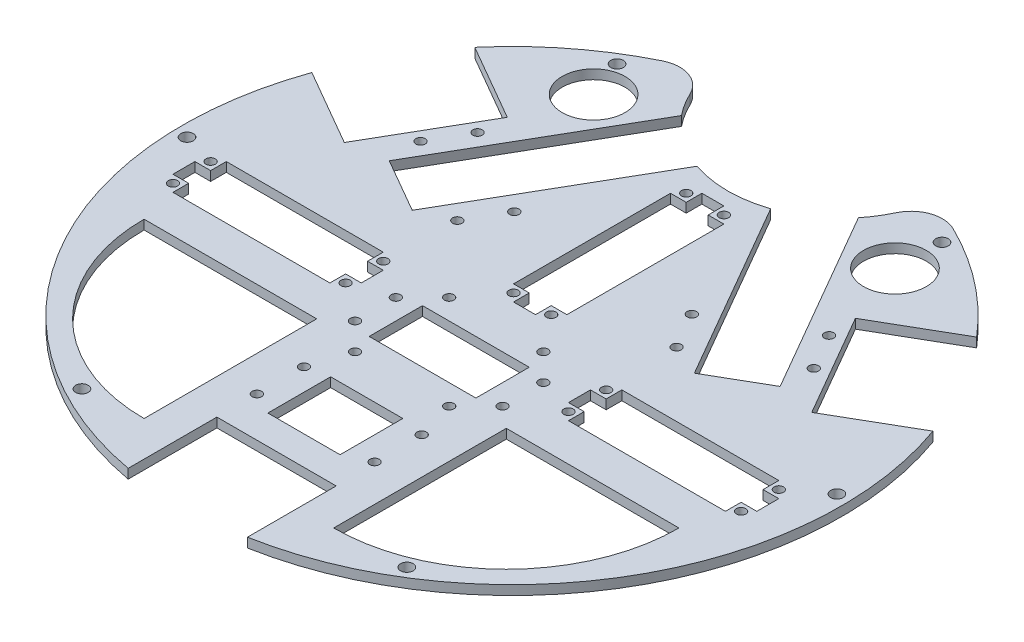
from build123d import *

# Parameters (mm, degrees)
CROQUIS1_R              = 105
SALIENTE_EXTRUIR1_DEPTH = 3
CORTAR_EXTRUIR1_START   = -3
CORTAR_EXTRUIR1_DEPTH   = 3
REDONDEO1_R             = 10
CROQUIS3_W              = 38
CROQUIS3_H              = 30
CORTAR_EXTRUIR2_DEPTH   = 149.522725677
MATRIZC2_COUNT          = 3
CORTAR_EXTRUIR3_DEPTH   = 148.302410171
CROQUIS5_R              = 1.5
CORTAR_EXTRUIR4_DEPTH   = 148.302410171
CROQUIS6_R              = 1.5
CORTAR_EXTRUIR5_DEPTH   = 148.302410171
CROQUIS7_R              = 1.5
CORTAR_EXTRUIR6_DEPTH   = 148.302410171
CROQUIS8_R              = 1.5
CORTAR_EXTRUIR8_DEPTH   = 10
CORTAR_EXTRUIR9_DEPTH   = 148.302410171
CROQUIS11_R             = 1.5
CORTAR_EXTRUIR10_DEPTH  = 148.302410171
CROQUIS12_R             = 1.5
CORTAR_EXTRUIR11_DEPTH  = 148.302410171
CROQUIS14_R             = 1.5
CORTAR_EXTRUIR15_DEPTH  = 148.302410171
CORTAR_EXTRUIR18_DEPTH  = 148.302410171
CROQUIS17_R             = 10
CORTAR_EXTRUIR19_DEPTH  = 148.302410171
CROQUIS19_R             = 1.5
CORTAR_EXTRUIR20_DEPTH  = 148.302410171
CROQUIS20_W             = 23
CROQUIS20_H             = 20
CORTAR_EXTRUIR21_DEPTH  = 148.302410171
CROQUIS21_R             = 1.5
CORTAR_EXTRUIR23_DEPTH  = 10
CROQUIS22_R             = 2
CORTAR_EXTRUIR24_DEPTH  = 148.302410171
CORTAR_EXTRUIR25_DEPTH  = 148.302410171
CROQUIS24_W             = 34
CROQUIS24_H             = 17
CORTAR_EXTRUIR26_DEPTH  = 148.302410171


with BuildPart() as part:
    # Croquis1 → Saliente-Extruir1 (new body)
    with BuildSketch(Plane(origin=(0, 0, 0), x_dir=(1, 0, 0), z_dir=(0, 1, 0))):
        with Locations(Location((0, 0, 0), (0, 0, 270))):
            Circle(CROQUIS1_R)
    extrude(amount=SALIENTE_EXTRUIR1_DEPTH)

    # Croquis2 → Cortar-Extruir1 (cut)
    with BuildSketch(Plane(origin=(0, 3, 0), x_dir=(1, 0, 0), z_dir=(0, 1, 0)).offset(CORTAR_EXTRUIR1_START)):
        with BuildLine():
            ThreePointArc((35.71668902, 98.738635424), (0, 68.738635424), (-35.71668902, 98.738635424))
            ThreePointArc((-35.71668902, 98.738635424), (0, 105), (35.71668902, 98.738635424))
        make_face()
    extrude(amount=CORTAR_EXTRUIR1_DEPTH, mode=Mode.SUBTRACT)

    # Redondeo1
    redondeo1_edges = [part.edges().sort_by_distance(p)[0] for p in [
        (-35.71668902, 1.5, -98.738635424),
        (35.71668902, 1.5, -98.738635424),
    ]]
    fillet(redondeo1_edges, radius=REDONDEO1_R)

    # Croquis3 → Cortar-Extruir2 (cut, through all)
    with BuildSketch(Plane(origin=(0, 3, 0), x_dir=(1, 0, 0), z_dir=(0, 1, 0))):
        with Locations((0, -90)):
            Rectangle(CROQUIS3_W, CROQUIS3_H)
    cortar_extruir2 = extrude(amount=-CORTAR_EXTRUIR2_DEPTH, mode=Mode.SUBTRACT)

    # MatrizC2: Cortar-Extruir2 ×3 about axis
    matrizc2_axis = Axis((0, 0, 0), (0, 1, 0))
    for i in range(1, MATRIZC2_COUNT):
        add(cortar_extruir2.rotate(matrizc2_axis, i * 360 / MATRIZC2_COUNT), mode=Mode.SUBTRACT)

    # Croquis4 → Cortar-Extruir3 (cut, through all)
    with BuildSketch(Plane(origin=(0, 3, 0), x_dir=(1, 0, 0), z_dir=(0, 1, 0))):
        Polygon((-88, -3), (-38, -3), (-38, -8), (-33, -8), (-33, -15), (-38, -15), (-38, -20), (-88, -20), (-88, -15), (-93, -15), (-93, -8), (-88, -8), align=None)
        Polygon((33, -15), (38, -15), (38, -20), (88, -20), (88, -15), (93, -15), (93, -8), (88, -8), (88, -3), (38, -3), (38, -8), (33, -8), align=None)
    extrude(amount=-CORTAR_EXTRUIR3_DEPTH, mode=Mode.SUBTRACT)

    # Croquis5 → Cortar-Extruir4 (cut, through all)
    with BuildSketch(Plane(origin=(0, 3, 0), x_dir=(1, 0, 0), z_dir=(0, 1, 0))):
        with Locations(Location((-90.5, -5.5, 0), (0, 0, 270))):
            Circle(CROQUIS5_R)
        with Locations(Location((90.5, -5.5, 0), (0, 0, 90))):
            Circle(CROQUIS5_R)
    extrude(amount=-CORTAR_EXTRUIR4_DEPTH, mode=Mode.SUBTRACT)

    # Croquis6 → Cortar-Extruir5 (cut, through all)
    with BuildSketch(Plane(origin=(0, 3, 0), x_dir=(1, 0, 0), z_dir=(0, 1, 0))):
        with Locations(Location((-90.5, -17.5, 0), (0, 0, 270))):
            Circle(CROQUIS6_R)
        with Locations(Location((90.5, -17.5, 0), (0, 0, 90))):
            Circle(CROQUIS6_R)
    extrude(amount=-CORTAR_EXTRUIR5_DEPTH, mode=Mode.SUBTRACT)

    # Croquis7 → Cortar-Extruir6 (cut, through all)
    with BuildSketch(Plane(origin=(0, 3, 0), x_dir=(1, 0, 0), z_dir=(0, 1, 0))):
        with Locations(Location((-35.5, -17.5, 0), (0, 0, 270))):
            Circle(CROQUIS7_R)
        with Locations(Location((35.5, -17.5, 0), (0, 0, 90))):
            Circle(CROQUIS7_R)
    extrude(amount=-CORTAR_EXTRUIR6_DEPTH, mode=Mode.SUBTRACT)

    # Croquis8 → Cortar-Extruir8 (cut)
    with BuildSketch(Plane(origin=(0, 3, 0), x_dir=(1, 0, 0), z_dir=(0, 1, 0))):
        with Locations(Location((-35.5, -5.5, 0), (0, 0, 270))):
            Circle(CROQUIS8_R)
        with Locations(Location((35.5, -5.5, 0), (0, 0, 270))):
            Circle(CROQUIS8_R)
    extrude(amount=-CORTAR_EXTRUIR8_DEPTH, mode=Mode.SUBTRACT)

    # Croquis10 → Cortar-Extruir9 (cut, through all)
    with BuildSketch(Plane(origin=(0, 3, 0), x_dir=(1, 0, 0), z_dir=(0, 1, 0))):
        Polygon((-3.5, 64), (3.5, 64), (3.5, 59), (8.5, 59), (8.5, 9), (3.5, 9), (3.5, 4), (-3.5, 4), (-3.5, 9), (-8.5, 9), (-8.5, 59), (-3.5, 59), align=None)
    extrude(amount=-CORTAR_EXTRUIR9_DEPTH, mode=Mode.SUBTRACT)

    # Croquis11 → Cortar-Extruir10 (cut, through all)
    with BuildSketch(Plane(origin=(0, 3, 0), x_dir=(1, 0, 0), z_dir=(0, 1, 0))):
        with Locations(Location((-6, 61.5, 0), (0, 0, 270))):
            Circle(CROQUIS11_R)
        with Locations(Location((6, 61.5, 0), (0, 0, 270))):
            Circle(CROQUIS11_R)
    extrude(amount=-CORTAR_EXTRUIR10_DEPTH, mode=Mode.SUBTRACT)

    # Croquis12 → Cortar-Extruir11 (cut, through all)
    with BuildSketch(Plane(origin=(0, 3, 0), x_dir=(1, 0, 0), z_dir=(0, 1, 0))):
        with Locations(Location((-6, 6.5, 0), (0, 0, 270))):
            Circle(CROQUIS12_R)
        with Locations(Location((6, 6.5, 0), (0, 0, 270))):
            Circle(CROQUIS12_R)
    extrude(amount=-CORTAR_EXTRUIR11_DEPTH, mode=Mode.SUBTRACT)

    # Croquis14 → Cortar-Extruir15 (cut, through all)
    with BuildSketch(Plane(origin=(0, 3, 0), x_dir=(1, 0, 0), z_dir=(0, 1, 0))):
        with Locations(Location((-19, -47.266645147, 0), (0, 0, 270))):
            Circle(CROQUIS14_R)
        with Locations(Location((-19, -62.266645147, 0), (0, 0, 270))):
            Circle(CROQUIS14_R)
        with Locations(Location((18.5, -47.266645147, 0), (0, 0, 270))):
            Circle(CROQUIS14_R)
        with Locations(Location((18.5, -62.266645147, 0), (0, 0, 270))):
            Circle(CROQUIS14_R)
    extrude(amount=-CORTAR_EXTRUIR15_DEPTH, mode=Mode.SUBTRACT)

    # Croquis16 → Cortar-Extruir18 (cut, through all)
    with BuildSketch(Plane(origin=(0, 3, 0), x_dir=(1, 0, 0), z_dir=(0, 1, 0))):
        with BuildLine():
            Line((-85.199337741, -32), (-30.199337741, -32))
            Line((-30.199337741, -32), (-30.199337741, -87))
            ThreePointArc((-30.199337741, -87), (-69.090210706, -70.890872965), (-85.199337741, -32))
        make_face()
        with BuildLine():
            Line((30.199337741, -32), (30.199337741, -87))
            ThreePointArc((30.199337741, -87), (69.090210706, -70.890872965), (85.199337741, -32))
            Line((85.199337741, -32), (30.199337741, -32))
        make_face()
    extrude(amount=-CORTAR_EXTRUIR18_DEPTH, mode=Mode.SUBTRACT)

    # Croquis17 → Cortar-Extruir19 (cut, through all)
    with BuildSketch(Plane(origin=(0, 3, 0), x_dir=(1, 0, 0), z_dir=(0, 1, 0))):
        with Locations(Location((-48, 74, 0), (0, 0, 270))):
            Circle(CROQUIS17_R)
        with Locations(Location((48, 74, 0), (0, 0, 90))):
            Circle(CROQUIS17_R)
    extrude(amount=-CORTAR_EXTRUIR19_DEPTH, mode=Mode.SUBTRACT)

    # Croquis19 → Cortar-Extruir20 (cut, through all)
    with BuildSketch(Plane(origin=(0, 3, 0), x_dir=(1, 0, 0), z_dir=(0, 1, 0))):
        with Locations(Location((-15, -35, 0), (0, 0, 270))):
            Circle(CROQUIS19_R)
        with Locations(Location((15, -35, 0), (0, 0, 270))):
            Circle(CROQUIS19_R)
        with Locations(Location((23.5, -13.5, 0), (0, 0, 270))):
            Circle(CROQUIS19_R)
        with Locations(Location((23.5, -26.5, 0), (0, 0, 270))):
            Circle(CROQUIS19_R)
        with Locations(Location((-23.5, -26.5, 0), (0, 0, 270))):
            Circle(CROQUIS19_R)
        with Locations(Location((-23.5, -13.5, 0), (0, 0, 270))):
            Circle(CROQUIS19_R)
        with Locations(Location((-15, -5, 0), (0, 0, 270))):
            Circle(CROQUIS19_R)
        with Locations(Location((15, -5, 0), (0, 0, 270))):
            Circle(CROQUIS19_R)
    extrude(amount=-CORTAR_EXTRUIR20_DEPTH, mode=Mode.SUBTRACT)

    # Croquis20 → Cortar-Extruir21 (cut, through all)
    with BuildSketch(Plane(origin=(0, 3, 0), x_dir=(1, 0, 0), z_dir=(0, 1, 0))):
        with Locations((-0.5, -55.766645147)):
            Rectangle(CROQUIS20_W, CROQUIS20_H)
    extrude(amount=-CORTAR_EXTRUIR21_DEPTH, mode=Mode.SUBTRACT)

    # Croquis21 → Cortar-Extruir23 (cut)
    with BuildSketch(Plane(origin=(0, 3, 0), x_dir=(1, 0, 0), z_dir=(0, 1, 0))):
        with Locations(Location((-62.637803669, 33.508141571, 0), (0, 0, 270))):
            Circle(CROQUIS21_R)
        with Locations(Location((-55.987803669, 45.026279442, 0), (0, 0, 270))):
            Circle(CROQUIS21_R)
        with Locations(Location((-28.274990748, 29.026279442, 0), (0, 0, 270))):
            Circle(CROQUIS21_R)
        with Locations(Location((-34.924990748, 17.508141571, 0), (0, 0, 270))):
            Circle(CROQUIS21_R)
        with Locations(Location((28.274990748, 29.026279442, 0), (0, 0, 270))):
            Circle(CROQUIS21_R)
        with Locations(Location((34.924990748, 17.508141571, 0), (0, 0, 270))):
            Circle(CROQUIS21_R)
        with Locations(Location((62.637803669, 33.508141571, 0), (0, 0, 270))):
            Circle(CROQUIS21_R)
        with Locations(Location((55.987803669, 45.026279442, 0), (0, 0, 270))):
            Circle(CROQUIS21_R)
    extrude(amount=-CORTAR_EXTRUIR23_DEPTH, mode=Mode.SUBTRACT)

    # Croquis22 → Cortar-Extruir24 (cut, through all)
    with BuildSketch(Plane(origin=(0, 3, 0), x_dir=(1, 0, 0), z_dir=(0, 1, 0))):
        with Locations(Location((-100.968056074, -2.540010349, 0), (0, 0, 270))):
            Circle(CROQUIS22_R)
        with Locations(Location((-52.683741526, 86.170896356, 0), (0, 0, 270))):
            Circle(CROQUIS22_R)
        with Locations(Location((48.284314549, 88.710906706, 0), (0, 0, 270))):
            Circle(CROQUIS22_R)
        with Locations(Location((100.968056074, 2.540010349, 0), (0, 0, 270))):
            Circle(CROQUIS22_R)
        with Locations(Location((52.683741526, -86.170896356, 0), (0, 0, 270))):
            Circle(CROQUIS22_R)
        with Locations(Location((-48.284314549, -88.710906706, 0), (0, 0, 270))):
            Circle(CROQUIS22_R)
    extrude(amount=-CORTAR_EXTRUIR24_DEPTH, mode=Mode.SUBTRACT)

    # Croquis23 → Cortar-Extruir25 (cut, through all)
    with BuildSketch(Plane(origin=(0, 3, 0), x_dir=(1, 0, 0), z_dir=(0, 1, 0))):
        Polygon((-62.258330249, 23.165408814), (-27.758330249, 82.921161675), (-10.437822174, 72.921161675), (-44.937822174, 13.165408814), align=None)
        Polygon((27.758330249, 82.921161675), (10.437822174, 72.921161675), (44.937822174, 13.165408814), (62.258330249, 23.165408814), align=None)
    extrude(amount=-CORTAR_EXTRUIR25_DEPTH, mode=Mode.SUBTRACT)

    # Croquis24 → Cortar-Extruir26 (cut, through all)
    with BuildSketch(Plane(origin=(0, 3, 0), x_dir=(1, 0, 0), z_dir=(0, 1, 0))):
        with Locations((0, -20)):
            Rectangle(CROQUIS24_W, CROQUIS24_H)
    extrude(amount=-CORTAR_EXTRUIR26_DEPTH, mode=Mode.SUBTRACT)


solid = part.part
